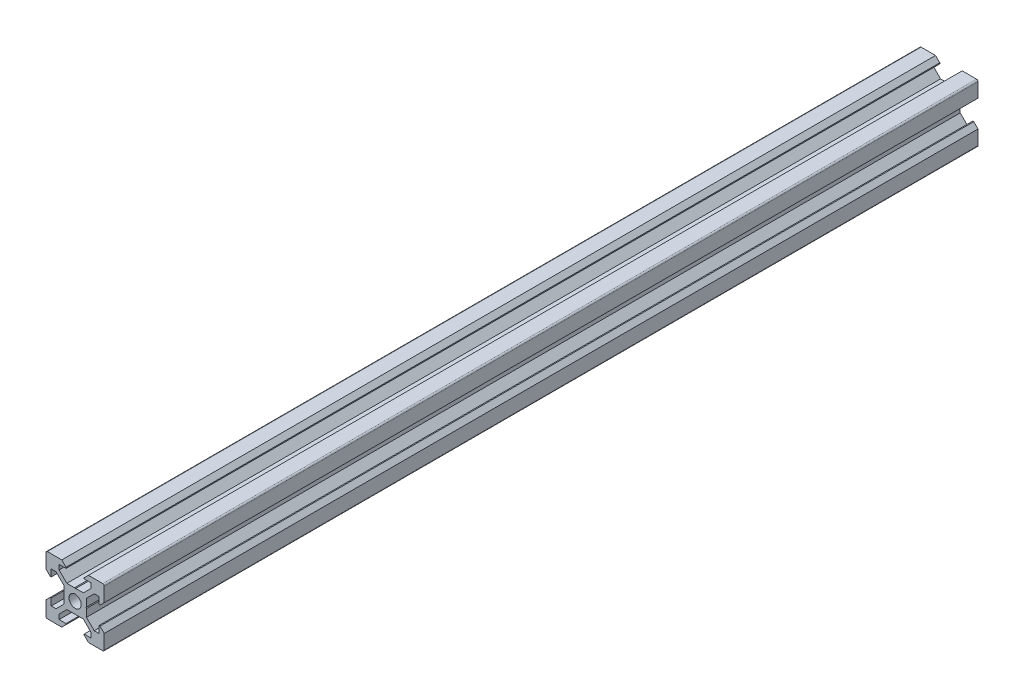
from build123d import *

# Parameters (mm, degrees)
BOSS_EXTRU_1_DEPTH           = 300
R_P_TITION_CIRCULAIRE1_COUNT = 4


with BuildPart() as part:
    # Esquisse1 → Boss.-Extru.1 (new body)
    with BuildSketch(Plane.XY):
        with BuildLine():
            Line((-9.5, 10), (-4.58, 10))
            Line((-4.58, 10), (-3.125, 8.545))
            Line((-3.125, 8.545), (-3.125, 8.2))
            Line((-3.125, 8.2), (-5.5, 8.2))
            Line((-5.5, 8.2), (-5.5, 6.560660172))
            Line((-5.5, 6.560660172), (-2.839339828, 3.9))
            Line((-2.839339828, 3.9), (-0.21, 3.9))
            Line((-0.21, 3.9), (0, 3.69))
            Line((0, 3.69), (0, 2.1))
            ThreePointArc((0, 2.1), (-1.48492424, 1.48492424), (-2.1, 0))
            Line((-2.1, 0), (-3.69, 0))
            Line((-3.69, 0), (-3.9, 0.21))
            Line((-3.9, 0.21), (-3.9, 2.839339828))
            Line((-3.9, 2.839339828), (-6.560660172, 5.5))
            Line((-6.560660172, 5.5), (-8.2, 5.5))
            Line((-8.2, 5.5), (-8.2, 3.125))
            Line((-8.2, 3.125), (-8.545, 3.125))
            Line((-8.545, 3.125), (-10, 4.58))
            Line((-10, 4.58), (-10, 9.5))
            ThreePointArc((-10, 9.5), (-9.853553391, 9.853553391), (-9.5, 10))
        make_face()
    boss_extru_1 = extrude(amount=BOSS_EXTRU_1_DEPTH)

    # Répétition circulaire1: Boss.-Extru.1 ×4 about axis
    r_p_tition_circulaire1_axis = Axis((0, 0, -13.782028156), (0, 0, 1))
    for i in range(1, R_P_TITION_CIRCULAIRE1_COUNT):
        add(boss_extru_1.rotate(r_p_tition_circulaire1_axis, i * 360 / R_P_TITION_CIRCULAIRE1_COUNT))


solid = part.part
